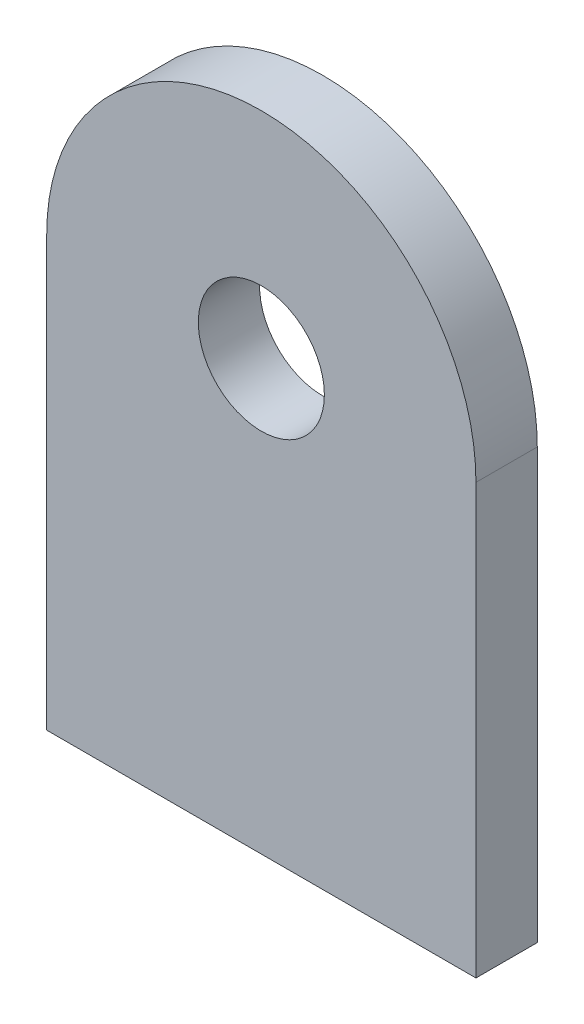
from build123d import *

# Parameters (mm, degrees)
SKETCH1_R           = 3.2639
BOSS_EXTRUDE1_DEPTH = 3.175


with BuildPart() as part:
    # Sketch1 → Boss-Extrude1 (new body)
    with BuildSketch(Plane.XY):
        with BuildLine():
            Line((0, 0), (22.225, 0))
            Line((22.225, 0), (22.225, 22.225))
            ThreePointArc((22.225, 22.225), (11.1125, 33.3375), (0, 22.225))
            Line((0, 22.225), (0, 0))
        make_face()
        with Locations((11.1125, 22.225)):
            Circle(SKETCH1_R, mode=Mode.SUBTRACT)
    extrude(amount=BOSS_EXTRUDE1_DEPTH)


solid = part.part
